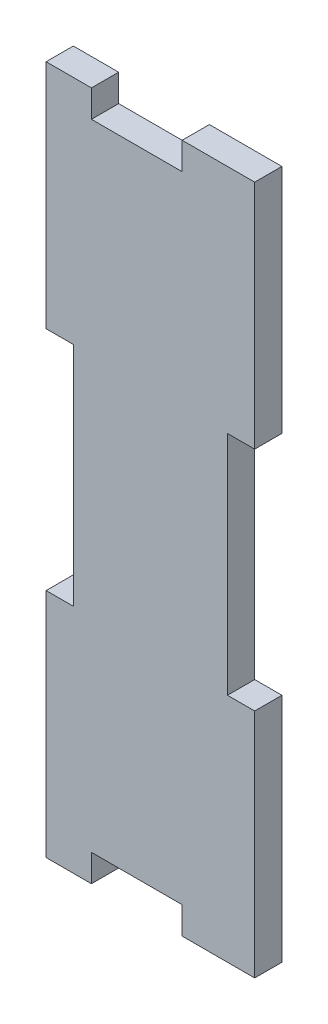
from build123d import *

# Parameters (mm, degrees)
BOSS_EXTRUDE1_DEPTH = 3


with BuildPart() as part:
    # Sketch1 → Boss-Extrude1 (new body)
    with BuildSketch(Plane.XY):
        Polygon((0, 76), (0, 50.5), (3, 50.5), (3, 25.5), (0, 25.5), (0, 0), (5, 0), (5, 3), (15, 3), (15, 0), (23, 0), (23, 25.5), (20, 25.5), (20, 50.5), (23, 50.5), (23, 76), (15, 76), (15, 73), (5, 73), (5, 76), align=None)
    extrude(amount=BOSS_EXTRUDE1_DEPTH)


solid = part.part
